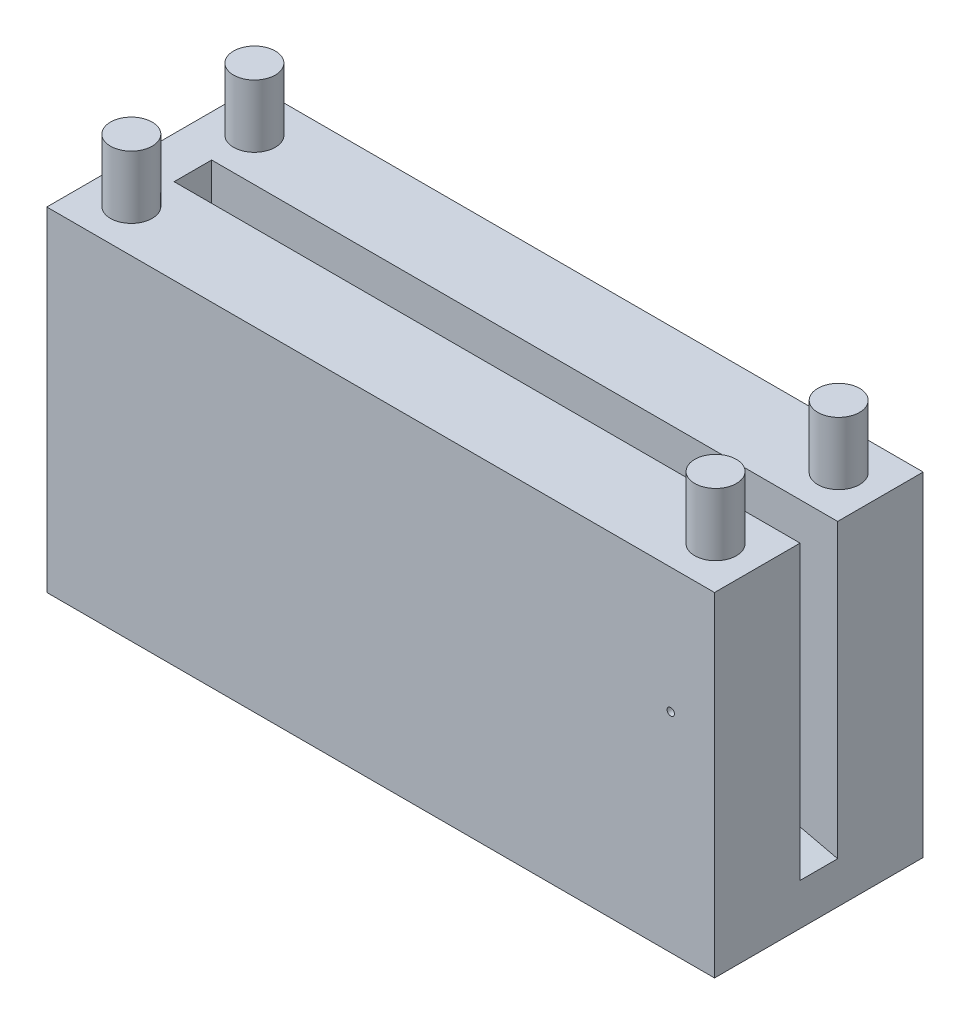
from build123d import *

# Parameters (mm, degrees)
SKETCH1_W               = 203.2
SKETCH1_H               = 63.5
BOSS_EXTRUDE1_DEPTH     = 101.6
SKETCH3_W               = 190.5
SKETCH3_H               = 11.43
CUT_EXTRUDE1_DEPTH      = 6.35
CUT_EXTRUDE2_DEPTH      = 11.43
SKETCH5_R               = 6.35
BOSS_EXTRUDE2_DEPTH     = 19.05
CUT_EXTRUDE3_DEPTH      = 163.119118937
CUT_EXTRUDE3_DEPTH_BACK = 163.119118937
SKETCH6_R               = 1.125000036


with BuildPart() as part:
    # Sketch1 → Boss-Extrude1 (new body)
    with BuildSketch(Plane(origin=(0, 0, 0), x_dir=(1, 0, 0), z_dir=(0, 1, 0))):
        Rectangle(SKETCH1_W, SKETCH1_H)
    extrude(amount=BOSS_EXTRUDE1_DEPTH)

    # Sketch3 → Cut-Extrude1 (cut)
    with BuildSketch(Plane(origin=(0, 101.6, 0), x_dir=(1, 0, 0), z_dir=(0, 1, 0))):
        with Locations((6.35, 0)):
            Rectangle(SKETCH3_W, SKETCH3_H)
    extrude(amount=-CUT_EXTRUDE1_DEPTH, mode=Mode.SUBTRACT)

    # Sketch4 → Cut-Extrude2 (cut)
    with BuildSketch(Plane.XY.offset(-5.715)):
        Polygon((-88.9, 101.6), (-88.9, 57.15), (101.6, 12.7), (101.6, 101.6), align=None)
    extrude(amount=CUT_EXTRUDE2_DEPTH, mode=Mode.SUBTRACT)

    # Sketch5 → Boss-Extrude2 (add)
    with BuildSketch(Plane(origin=(0, 101.6, 0), x_dir=(1, 0, 0), z_dir=(0, 1, 0))):
        with Locations(Location((88.9, -18.7325, 0), (0, 0, 90))):
            Circle(SKETCH5_R)
        with Locations(Location((-88.9, -18.7325, 0), (0, 0, 90))):
            Circle(SKETCH5_R)
        with Locations(Location((-88.9, 18.7325, 0), (0, 0, 90))):
            Circle(SKETCH5_R)
        with Locations(Location((88.9, 18.7325, 0), (0, 0, 90))):
            Circle(SKETCH5_R)
    extrude(amount=BOSS_EXTRUDE2_DEPTH)

    # Sketch6 → Cut-Extrude3 (cut, two sides: drawn at the far end of the back side and taken through both)
    with BuildSketch(Plane.XY.offset(-5.715).offset(-CUT_EXTRUDE3_DEPTH_BACK)):
        with Locations((88.265, 63.5)):
            Circle(SKETCH6_R)
    extrude(amount=CUT_EXTRUDE3_DEPTH + CUT_EXTRUDE3_DEPTH_BACK, mode=Mode.SUBTRACT)


solid = part.part
